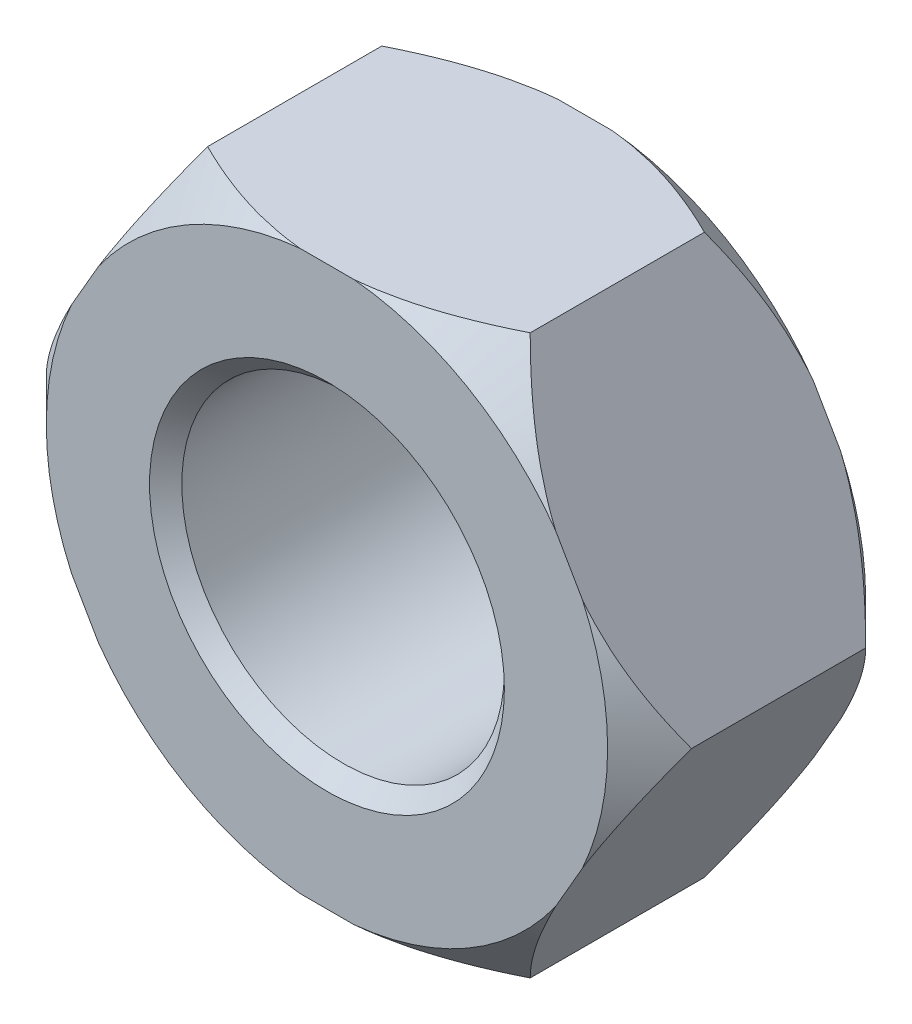
from build123d import *

# Parameters (mm, degrees)
BOSS_EXTRUDE1_DEPTH = 4
SKETCH2_R           = 5
CUT_EXTRUDE1_DEPTH  = 16.459624834
CHAMFER1_SIZE       = 0.5


with BuildPart() as part:
    # Sketch1 → Boss-Extrude1 (new, symmetric)
    with BuildSketch(Plane.XY):
        Polygon((-10, 0), (-5, -8.660254038), (5, -8.660254038), (10, 0), (5, 8.660254038), (-5, 8.660254038), align=None)
    extrude(amount=BOSS_EXTRUDE1_DEPTH, both=True)

    # Sketch2 → Cut-Extrude1 (cut, through all)
    with BuildSketch(Plane.XY.offset(-4)):
        Circle(SKETCH2_R)
    extrude(amount=CUT_EXTRUDE1_DEPTH, mode=Mode.SUBTRACT)

    # Sketch8 → Cut-Revolve1 (revolve, cut)
    with BuildSketch(Plane(origin=(0, 0, 0), x_dir=(1, 0, 0), z_dir=(0, 1, 0))):
        Polygon((-8.6, -4.1), (-10.1, -4.1), (-10.1, -2.6), align=None)
    cut_revolve1 = revolve(axis=Axis((0, 0, -7.705), (0, 0, 1)), mode=Mode.SUBTRACT)

    # Mirror1: Cut-Revolve1 across plane
    add(cut_revolve1.mirror(Plane.XY), mode=Mode.SUBTRACT)

    # Chamfer1
    chamfer1_edges = [part.edges().sort_by_distance(p)[0] for p in [
        (-5, 0, -4),
        (-5, 0, 4),
    ]]
    chamfer(chamfer1_edges, length=CHAMFER1_SIZE)


solid = part.part
